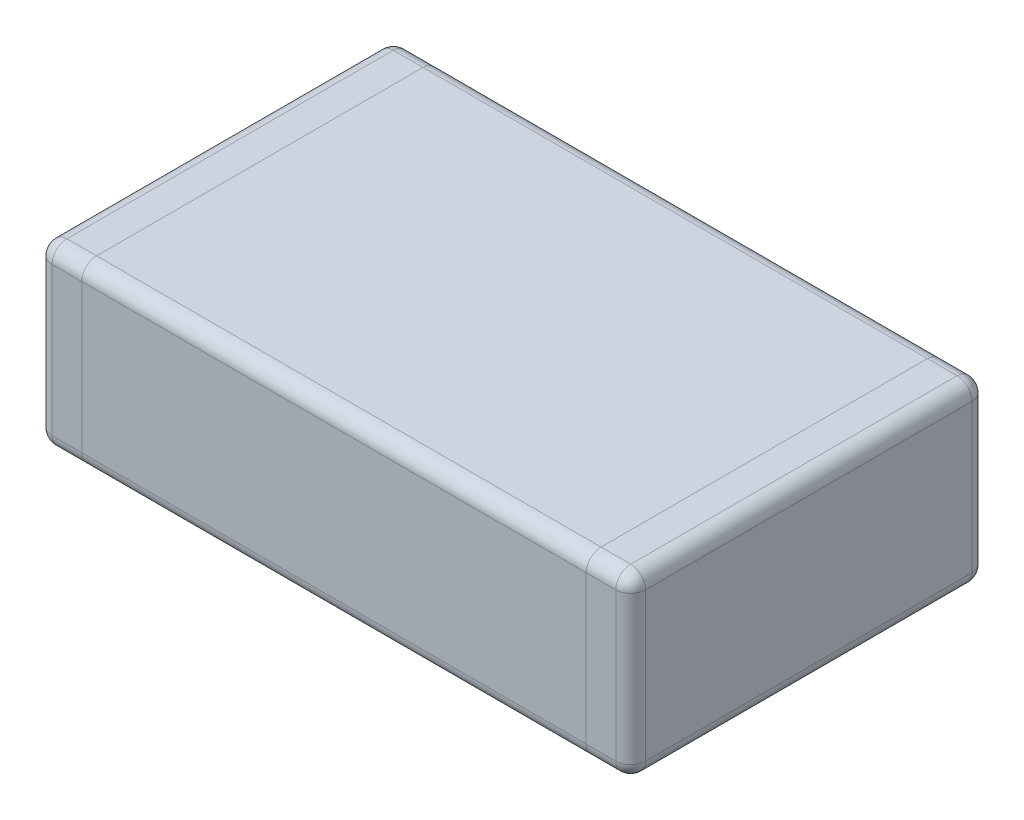
from build123d import *

# Parameters (mm, degrees)
SKETCH1_W      = 2
SKETCH1_H      = 1.2
EXTRUDE1_DEPTH = 0.6
FILLET1_R      = 0.05


with BuildPart() as part:
    # Sketch1 → Extrude1 (new body)
    with BuildSketch(Plane(origin=(0, 0, 0), x_dir=(1, 0, 0), z_dir=(0, 1, 0))):
        Rectangle(SKETCH1_W, SKETCH1_H)
    extrude(amount=EXTRUDE1_DEPTH)

    # Fillet1
    fillet1_edges = [part.edges().sort_by_distance(p)[0] for p in [
        (-1, 0.6, 0),
        (0, 0.6, 0.6),
        (1, 0.6, 0),
        (0, 0, 0.6),
        (-1, 0, 0),
        (0, 0, -0.6),
        (1, 0, 0),
        (0, 0.6, -0.6),
        (1, 0.3, 0.6),
        (-1, 0.3, 0.6),
        (-1, 0.3, -0.6),
        (1, 0.3, -0.6),
    ]]
    fillet(fillet1_edges, radius=FILLET1_R)


solid = part.part
